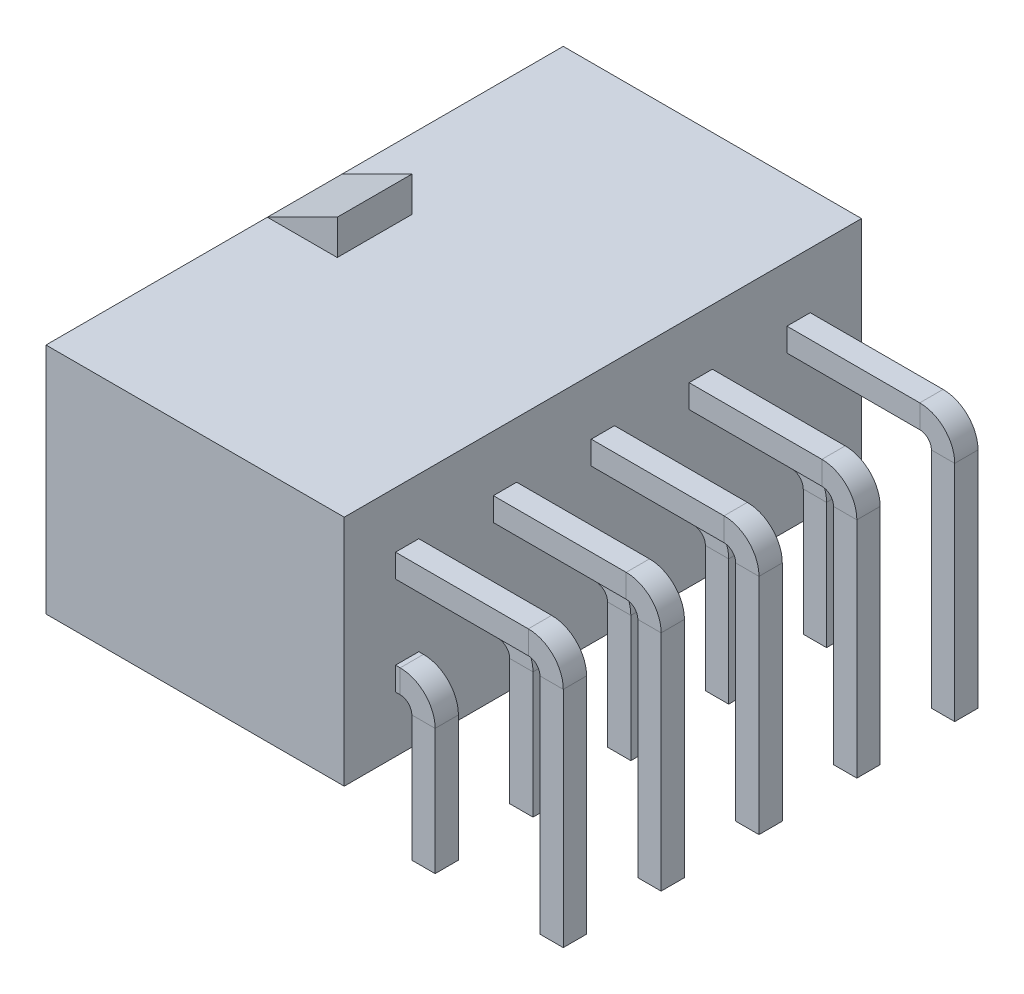
from build123d import *

# Parameters (mm, degrees)
SKETCH_1_W                  = 12.8
SKETCH_1_H                  = 22.2
EXTRUDE_1_DEPTH             = 10
SKETCH_3_W                  = 4
SKETCH_3_H                  = 4
CUT_EXTRUDE_1_DEPTH         = 6.4
PATTERN_LINEAR_1_COUNT      = 5
PATTERN_LINEAR_1_PITCH      = 4.2
PATTERN_LINEAR_1_COUNT_DIR2 = 2
PATTERN_LINEAR_1_PITCH_DIR2 = 4.2
SKETCH_12_W                 = 1
SKETCH_12_H                 = 1
CUT_EXTRUDE_2_DEPTH         = 6.4
PATTERN_LINEAR_2_COUNT      = 5
PATTERN_LINEAR_2_PITCH      = 4.2
PATTERN_LINEAR_2_COUNT_DIR2 = 2
PATTERN_LINEAR_2_PITCH_DIR2 = 4.2
SKETCH_14_W                 = 1
SKETCH_14_H                 = 1
SKETCH_16_W                 = 1
SKETCH_16_H                 = 1
PATTERN_LINEAR_3_COUNT      = 5
PATTERN_LINEAR_3_PITCH      = 4.2
SKETCH_18_W                 = 3
SKETCH_18_H                 = 3.2
EXTRUDE_2_DEPTH             = 1.5
CUT_EXTRUDE_3_DEPTH         = 3.2


with BuildPart() as part:
    # Эскиз1 → Бобышка-Вытянуть1 (new body)
    with BuildSketch(Plane(origin=(0, 0, 0), x_dir=(1, 0, 0), z_dir=(0, 1, 0))):
        Rectangle(SKETCH_1_W, SKETCH_1_H)
    extrude(amount=EXTRUDE_1_DEPTH)

    # Эскиз3 → Вырез-Вытянуть1 (cut)
    with BuildSketch(Plane.ZY.offset(6.4)):
        with Locations((-8.4, 7.1)):
            Rectangle(SKETCH_3_W, SKETCH_3_H)
    cut_extrude_1 = extrude(amount=-CUT_EXTRUDE_1_DEPTH, mode=Mode.SUBTRACT)

    # Линейный массив1: Cut-Extrude 1 5 × 2
    with Locations(*[(0, -j * PATTERN_LINEAR_1_PITCH_DIR2, i * PATTERN_LINEAR_1_PITCH) for i in range(PATTERN_LINEAR_1_COUNT) for j in range(PATTERN_LINEAR_1_COUNT_DIR2) if (i, j) != (0, 0)]):
        add(cut_extrude_1, mode=Mode.SUBTRACT)

    # Эскиз12 → Вырез-Вытянуть2 (cut)
    with BuildSketch(Plane(origin=(6.4, 0, 0), x_dir=(0, 0, -1), z_dir=(1, 0, 0))):
        with Locations((-8.4, 7.1)):
            Rectangle(SKETCH_12_W, SKETCH_12_H)
    cut_extrude_2 = extrude(amount=-CUT_EXTRUDE_2_DEPTH, mode=Mode.SUBTRACT)

    # Линейный массив2: Cut-Extrude 2 5 × 2
    with Locations(*[(0, -j * PATTERN_LINEAR_2_PITCH_DIR2, -i * PATTERN_LINEAR_2_PITCH) for i in range(PATTERN_LINEAR_2_COUNT) for j in range(PATTERN_LINEAR_2_COUNT_DIR2) if (i, j) != (0, 0)]):
        add(cut_extrude_2, mode=Mode.SUBTRACT)

    # По траектории6: sweep along a path in Эскиз15
    with BuildLine(Plane.XY.offset(11.1)) as sweep_6_path:
        Line((-3, 7.1), (12.1, 7.1))
        ThreePointArc((12.1, 7.1), (12.807106781, 6.807106781), (13.1, 6.1))
        Line((13.1, 6.1), (13.1, -3.5))
    # Эскиз14 → По траектории6 (sweep)
    with BuildSketch(Plane(origin=(0, -3.5, 0), x_dir=(1, 0, 0), z_dir=(0, 1, 0))):
        with Locations((13.1, -8.4)):
            Rectangle(SKETCH_14_W, SKETCH_14_H)
    sweep_6 = sweep(path=sweep_6_path.line)

    # По траектории7: sweep along a path in Эскиз17
    with BuildLine(Plane.XY.offset(11.1)) as sweep_7_path:
        Line((7.6, -3.5), (7.6, 1.9))
        ThreePointArc((7.6, 1.9), (7.307106781, 2.607106781), (6.6, 2.9))
        Line((6.6, 2.9), (-3, 2.9))
    # Эскиз16 → По траектории7 (sweep)
    with BuildSketch(Plane(origin=(0, -3.5, 0), x_dir=(1, 0, 0), z_dir=(0, 1, 0))):
        with Locations((7.6, -8.4)):
            Rectangle(SKETCH_16_W, SKETCH_16_H)
    sweep_7 = sweep(path=sweep_7_path.line)

    # Линейный массив3: По траектории6, По траектории7 ×5
    with Locations(*[(0, 0, -i * PATTERN_LINEAR_3_PITCH) for i in range(1, PATTERN_LINEAR_3_COUNT)]):
        add(sweep_6)
        add(sweep_7)

    # Эскиз18 → Бобышка-Вытянуть2 (add)
    with BuildSketch(Plane(origin=(0, 10, 0), x_dir=(1, 0, 0), z_dir=(0, 1, 0))):
        with Locations((-4.9, 0)):
            Rectangle(SKETCH_18_W, SKETCH_18_H)
    extrude(amount=EXTRUDE_2_DEPTH)

    # Эскиз19 → Вырез-Вытянуть3 (cut)
    with BuildSketch(Plane.XY.offset(1.6)):
        Polygon((-3.4, 11.5), (-6.4, 10), (-6.4, 11.5), align=None)
    extrude(amount=-CUT_EXTRUDE_3_DEPTH, mode=Mode.SUBTRACT)


solid = part.part
